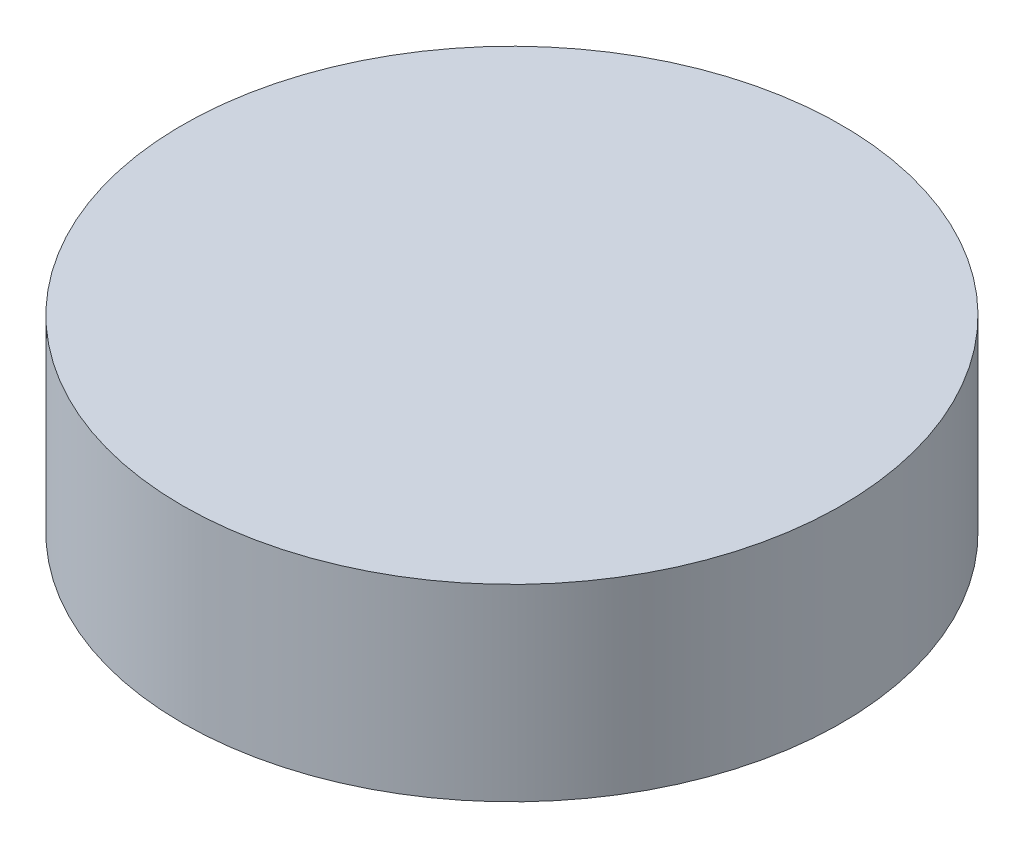
from build123d import *

# Parameters (mm, degrees)
SKETCH1_R           = 3.5
BOSS_EXTRUDE1_DEPTH = 2


with BuildPart() as part:
    # Sketch1 → Boss-Extrude1 (new body)
    with BuildSketch(Plane(origin=(0, 0, 0), x_dir=(1, 0, 0), z_dir=(0, 1, 0))):
        with Locations(Location((0, 0, 0), (0, 0, 270))):
            Circle(SKETCH1_R)
    extrude(amount=BOSS_EXTRUDE1_DEPTH)


solid = part.part
